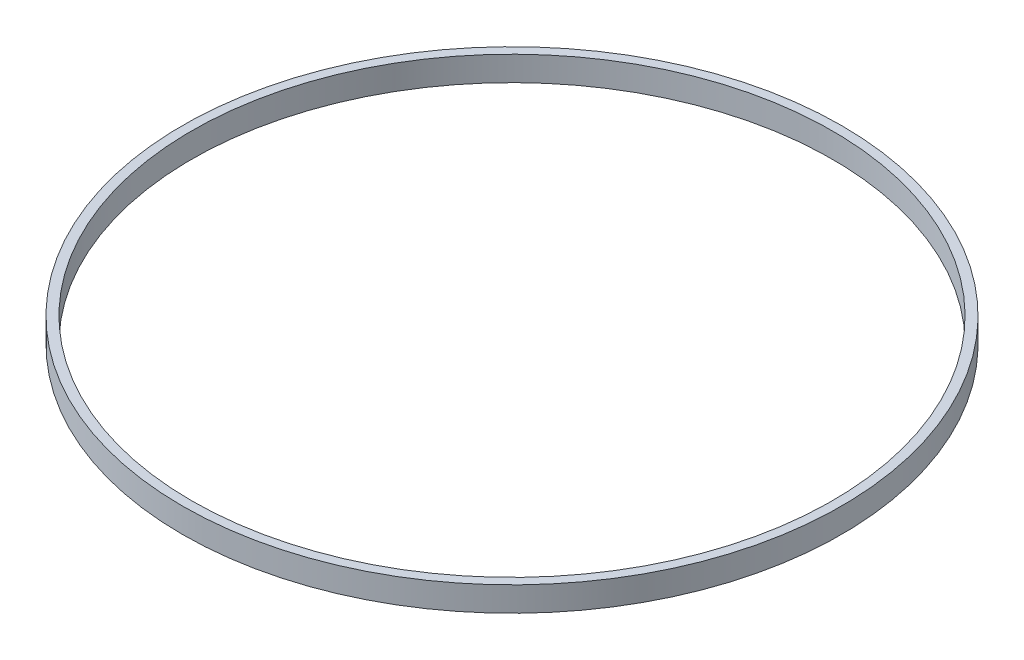
from build123d import *

# Parameters (mm, degrees)
SKETCH1_W = 1.62
SKETCH1_H = 4.35


with BuildPart() as part:
    # Sketch1 → Revolve1 (revolve)
    with BuildSketch(Plane(origin=(0, 0, 0), x_dir=(-1, 0, 0), z_dir=(0, 0, -1)), mode=Mode.PRIVATE) as revolve1_sk:
        with Locations((-57.39, 2.379397727)):
            Rectangle(SKETCH1_W, SKETCH1_H)
    revolve(revolve1_sk.sketch.rotate(Axis((0, 0, 0), (0, 1, 0)), 270), axis=Axis((0, 0, 0), (0, 1, 0)))


solid = part.part
